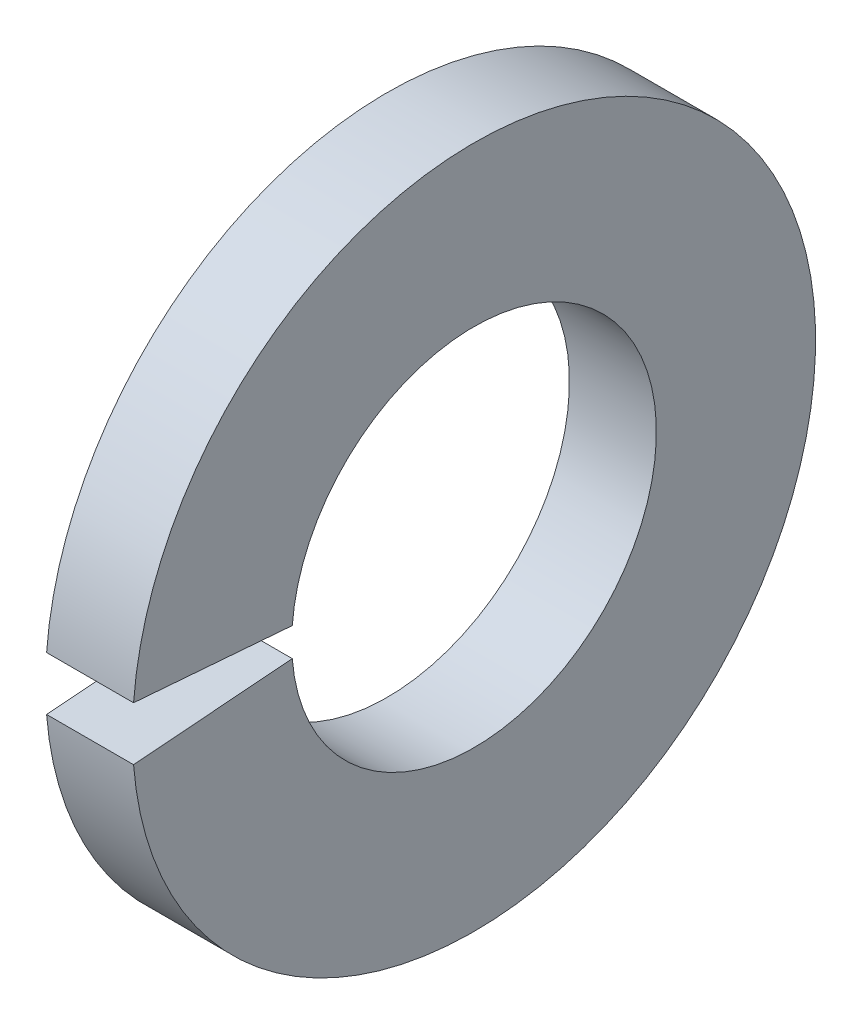
from build123d import *

# Parameters (mm, degrees)
SKETCH1_W = 1.5748
SKETCH1_H = 2.8829
GAP_DEPTH = 9.887405193


with BuildPart() as part:
    # Sketch1 → Base-Revolve (revolve)
    with BuildSketch(Plane.XY, mode=Mode.PRIVATE) as base_revolve_sk:
        with Locations((-0.7874, 4.74345)):
            Rectangle(SKETCH1_W, SKETCH1_H)
    revolve(base_revolve_sk.sketch.rotate(Axis((-34.925, 0, 0), (1, 0, 0)), 90), axis=Axis((-34.925, 0, 0), (1, 0, 0)))

    # Sketch2 → Gap (cut, through all)
    with BuildSketch(Plane(origin=(0, 0, 0), x_dir=(0, -1, 0), z_dir=(-1, 0, 0))):
        with BuildLine():
            Line((0, 0), (0.494966894, 6.289150698))
            ThreePointArc((0.494966894, 6.289150698), (0, 6.308598), (-0.494966894, 6.289150698))
            Line((-0.494966894, 6.289150698), (0, 0))
        make_face()
    extrude(amount=GAP_DEPTH, mode=Mode.SUBTRACT)


solid = part.part
